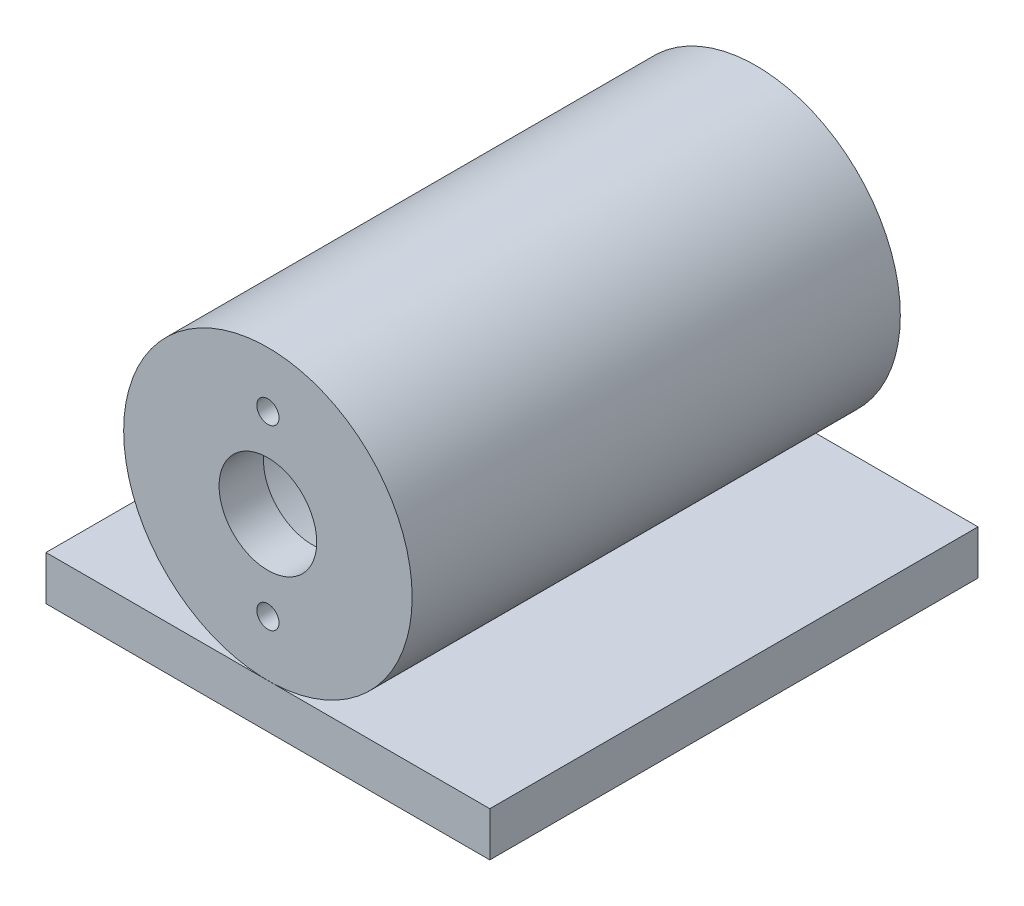
from build123d import *

# Parameters (mm, degrees)
SKETCH1_R           = 20.6375
SKETCH1_R_2         = 19.05
SKETCH1_R_3         = 1.5875
SKETCH1_R_4         = 6.985
BOSS_EXTRUDE1_DEPTH = 6.35
BOSS_EXTRUDE2_START = 63.5
SKETCH2_R           = 20.6375
SKETCH2_R_2         = 17.4625
BOSS_EXTRUDE2_DEPTH = 63.5
BOSS_EXTRUDE3_DEPTH = 6.35


with BuildPart() as part:
    # Sketch1 → Boss-Extrude1 (new body)
    # profile 1 of 2: a face of its own
    with BuildSketch(Plane.XY):
        Circle(SKETCH1_R)
        Circle(SKETCH1_R_2, mode=Mode.SUBTRACT)
    # profile 2 of 2: a face of its own
    with BuildSketch(Plane.XY):
        Circle(SKETCH1_R_2)
        with Locations((0, -12.7)):
            Circle(SKETCH1_R_3, mode=Mode.SUBTRACT)
        with Locations((0, 12.7)):
            Circle(SKETCH1_R_3, mode=Mode.SUBTRACT)
        Circle(SKETCH1_R_4, mode=Mode.SUBTRACT)
    extrude(amount=BOSS_EXTRUDE1_DEPTH)

    # Sketch2 → Boss-Extrude2 (add)
    with BuildSketch(Plane(origin=(0, 0, 0), x_dir=(-1, 0, 0), z_dir=(0, 0, -1)).offset(BOSS_EXTRUDE2_START)):
        Circle(SKETCH2_R)
        Circle(SKETCH2_R_2, mode=Mode.SUBTRACT)
    extrude(amount=-BOSS_EXTRUDE2_DEPTH)


with BuildPart() as body_2:
    # 3DSketch2 → Boss-Extrude3 (new body)
    with BuildSketch(Plane(origin=(-31.75, -20.6375, 6.35), x_dir=(0.6726727939963125, 0, -0.7399400733959437), z_dir=(0, -1, 0))):
        Polygon((0, 0), (42.714722419, 46.986194661), (94.399536545, 0), (51.684814127, -46.986194661), align=None)
    extrude(amount=BOSS_EXTRUDE3_DEPTH)


solid = Compound([part.part, body_2.part])
